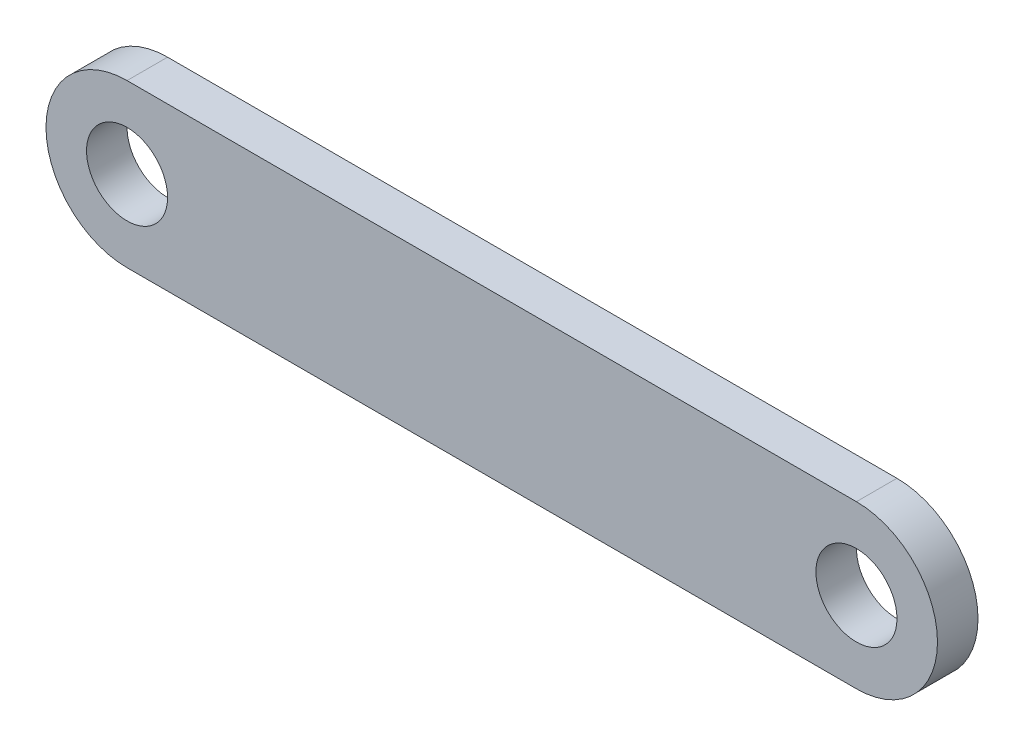
from build123d import *

# Parameters (mm, degrees)
SKETCH1_R           = 2.5
BOSS_EXTRUDE1_DEPTH = 2.5


with BuildPart() as part:
    # Sketch1 → Boss-Extrude1 (new body)
    with BuildSketch(Plane.XY):
        with BuildLine():
            Line((-22.5, 5), (22.5, 5))
            ThreePointArc((22.5, 5), (27.5, 0), (22.5, -5))
            Line((22.5, -5), (-22.5, -5))
            ThreePointArc((-22.5, -5), (-27.5, 0), (-22.5, 5))
        make_face()
        with Locations((-22.5, 0)):
            Circle(SKETCH1_R, mode=Mode.SUBTRACT)
        with Locations((22.5, 0)):
            Circle(SKETCH1_R, mode=Mode.SUBTRACT)
    extrude(amount=BOSS_EXTRUDE1_DEPTH)


solid = part.part
